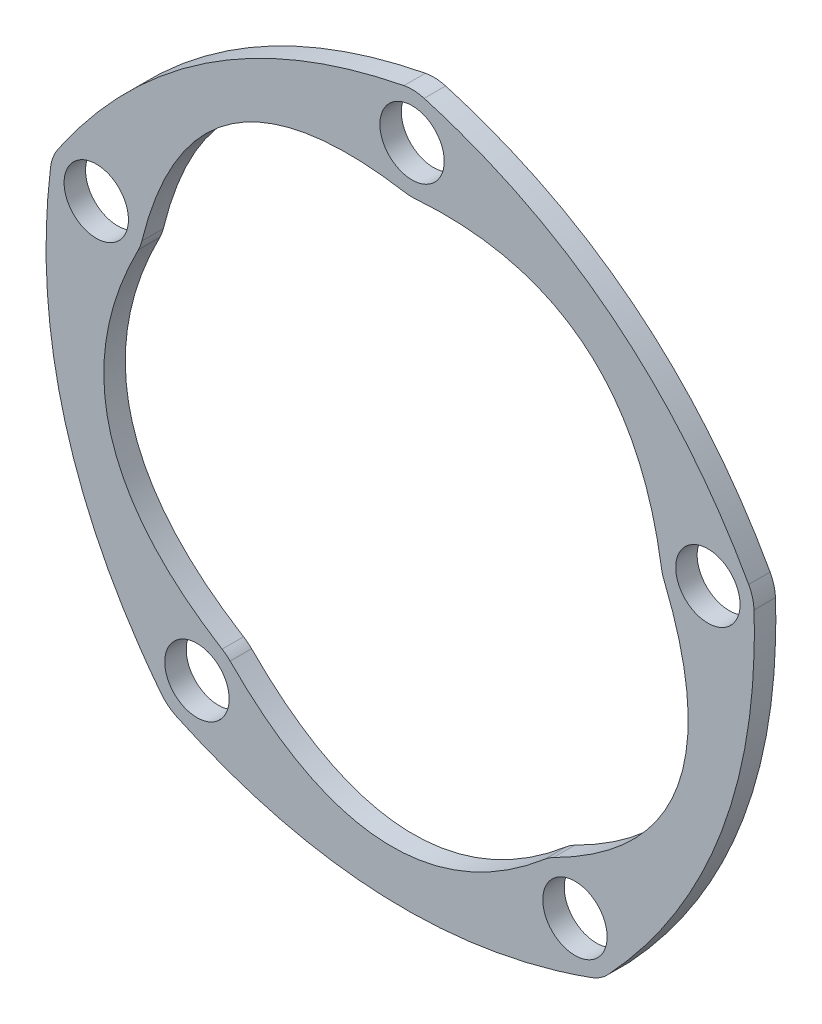
from build123d import *

# Parameters (mm, degrees)
SKETCH_1_R      = 1.5
EXTRUDE_1_DEPTH = 1


with BuildPart() as part:
    # 草图1 → 凸台-拉伸1 (new body)
    with BuildSketch(Plane.XY):
        with BuildLine():
            ThreePointArc((9.027564348, -14.530044737), (9.452188044, -14.317284831), (9.814671703, -14.010401047))
            add(Edge.make_bspline(
                [(9.814671703, -14.010401047), (12.18822328, -11.458756692), (15.692863494, -5.893557839), (16.722450019, 0.624994049), (16.609112546, 4.098471157)],
                knots=[0.022064742, 0.022064742, 0.022064742, 0.022064742, 0.499959338, 0.977990906, 0.977990906, 0.977990906, 0.977990906], degree=3))
            ThreePointArc((16.609112546, 4.098471157), (16.53806505, 4.565454975), (16.359479137, 5.002752018))
            add(Edge.make_bspline(
                [(16.359479137, 5.002752018), (14.674806415, 8.042450428), (10.446892996, 13.109630634), (4.583537519, 16.088725104), (1.237093036, 17.061322309)],
                knots=[0.022009094, 0.022009094, 0.022009094, 0.022009094, 0.500040662, 0.977935258, 0.977935258, 0.977935258, 0.977935258], degree=3))
            ThreePointArc((1.237093036, 17.061322309), (0.768508115, 17.138783476), (0.294870912, 17.103571828))
            add(Edge.make_bspline(
                [(0.294870912, 17.103571828), (-3.125200659, 16.434385016), (-9.231172481, 13.992221488), (-13.895447236, 9.324238792), (-15.845236863, 6.448095314)],
                knots=[0.022064742, 0.022064742, 0.022064742, 0.022064742, 0.499960608, 0.977922402, 0.977922402, 0.977922402, 0.977922402], degree=3))
            ThreePointArc((-15.845236863, 6.448095314), (-16.062723303, 6.027327569), (-16.175163145, 5.567215485))
            add(Edge.make_bspline(
                [(-16.175163145, 5.567215485), (-16.595831692, 2.107197873), (-16.160161694, -4.45559692), (-13.161387867, -10.33481003), (-11.028034261, -13.078319909)],
                knots=[0.021996491, 0.021996491, 0.021996491, 0.021996491, 0.499960843, 0.977990945, 0.977990945, 0.977990945, 0.977990945], degree=3))
            ThreePointArc((-11.028034261, -13.078319909), (-10.696067568, -13.414360903), (-10.294548569, -13.663173939))
            add(Edge.make_bspline(
                [(-10.294548569, -13.663173939), (-7.144931204, -15.132114571), (-0.746064836, -16.746443383), (5.74855557, -15.710187793), (9.027564348, -14.530044737)],
                knots=[0.022009307, 0.022009307, 0.022009307, 0.022009307, 0.500040658, 0.977935258, 0.977935258, 0.977935258, 0.977935258], degree=3))
        make_face()
        with Locations((8.264326198, -12.518023506)):
            Circle(SKETCH_1_R, mode=Mode.SUBTRACT)
        with Locations((-9.351530584, -11.728123283)):
            Circle(SKETCH_1_R, mode=Mode.SUBTRACT)
        with Locations((-14.043889946, 5.269644693)):
            Circle(SKETCH_1_R, mode=Mode.SUBTRACT)
        with Locations((0.671929263, 14.984942812)):
            Circle(SKETCH_1_R, mode=Mode.SUBTRACT)
        with Locations((14.459165069, 3.991559284)):
            Circle(SKETCH_1_R, mode=Mode.SUBTRACT)
        with BuildLine():
            ThreePointArc((-12.084118167, 4.284259186), (-11.989009709, 4.498598439), (-11.919642267, 4.722596412))
            add(Edge.make_bspline(
                [(0.333250802, 12.818762133), (-2.935666702, 13.36550918), (-8.291080057, 12.535805727), (-11.122073794, 7.958530689), (-11.919642267, 4.722596412)],
                knots=[0.011876539, 0.011876539, 0.011876539, 0.011876539, 0.500003959, 0.988536873, 0.988536873, 0.988536873, 0.988536873], degree=3))
            ThreePointArc((0.333250802, 12.818762133), (0.573655745, 12.793365714), (0.815368633, 12.797159765))
            add(Edge.make_bspline(
                [(12.293898461, 3.640629682), (11.788818781, 6.932897703), (9.378560044, 11.743845098), (4.119958064, 13.049350775), (0.815368633, 12.797159765)],
                knots=[0.011651073, 0.011651073, 0.011651073, 0.011651073, 0.499978932, 0.988122793, 0.988122793, 0.988122793, 0.988122793], degree=3))
            ThreePointArc((12.293898461, 3.640629682), (12.343962742, 3.407799774), (12.421347321, 3.182571388))
            add(Edge.make_bspline(
                [(7.261467235, -10.567176253), (10.236427241, -9.069498048), (14.068062226, -5.28940284), (13.683697639, 0.116101841), (12.421347321, 3.182571388)],
                knots=[0.011651023, 0.011651023, 0.011651023, 0.011651023, 0.499963297, 0.988308236, 0.988308236, 0.988308236, 0.988308236], degree=3))
            ThreePointArc((7.261467235, -10.567176253), (7.05550434, -10.686738072), (6.865213221, -10.829933857))
            add(Edge.make_bspline(
                [(-7.806108488, -10.171458919), (-5.462403522, -12.538035871), (-0.683269899, -15.014043888), (4.338910959, -12.978090664), (6.865213221, -10.829933857)],
                knots=[0.011648007, 0.011648007, 0.011648007, 0.011648007, 0.499963567, 0.988308296, 0.988308296, 0.988308296, 0.988308296], degree=3))
            ThreePointArc((-7.806108488, -10.171458919), (-7.983418072, -10.012559189), (-8.178354084, -9.875855991))
            add(Edge.make_bspline(
                [(-12.084118167, 4.284259186), (-13.612076453, 1.322501907), (-14.491074702, -3.988767844), (-11.002068971, -8.136759896), (-8.178354084, -9.875855991)],
                knots=[0.011463127, 0.011463127, 0.011463127, 0.011463127, 0.499980132, 0.988311969, 0.988311969, 0.988311969, 0.988311969], degree=3))
        make_face(mode=Mode.SUBTRACT)
    extrude(amount=EXTRUDE_1_DEPTH)


solid = part.part
